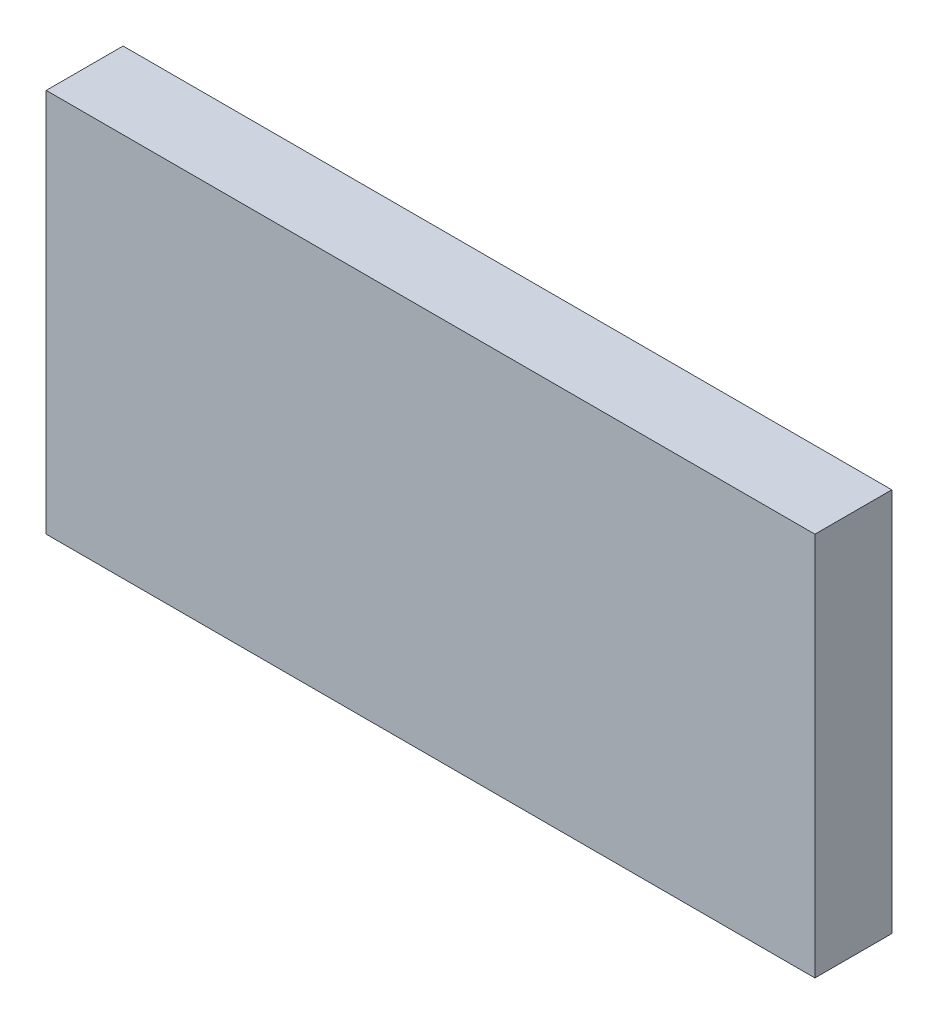
from build123d import *

# Parameters (mm, degrees)
SKETCH1_W           = 40
SKETCH1_H           = 20
BOSS_EXTRUDE1_DEPTH = 4


with BuildPart() as part:
    # Sketch1 → Boss-Extrude1 (new body)
    with BuildSketch(Plane.XY):
        Rectangle(SKETCH1_W, SKETCH1_H)
    extrude(amount=BOSS_EXTRUDE1_DEPTH)


solid = part.part
